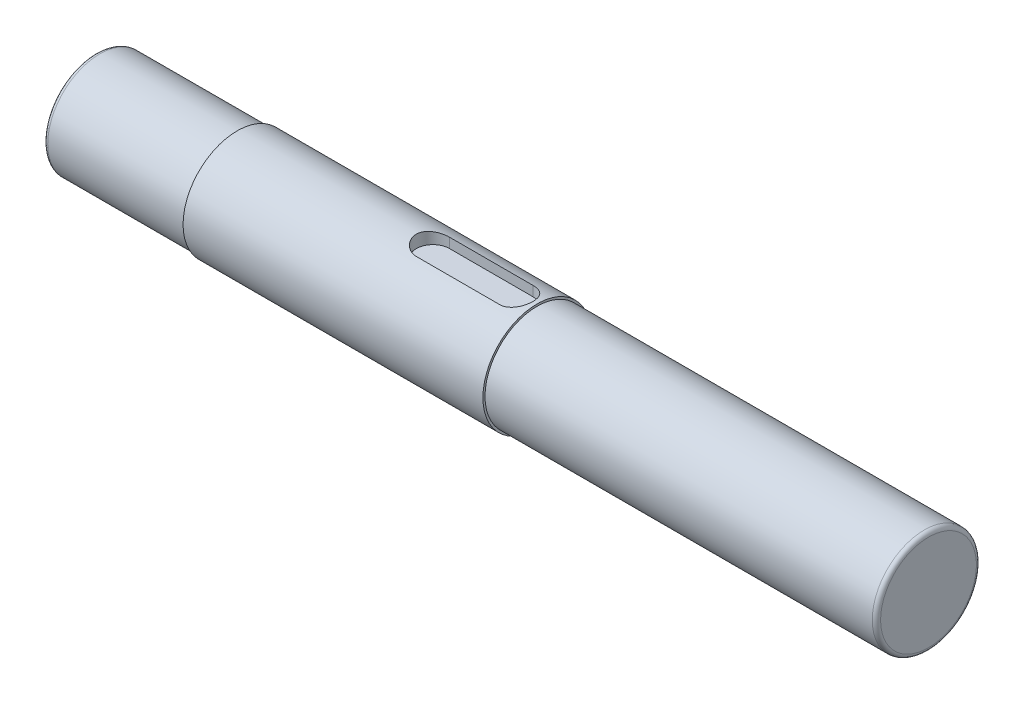
from build123d import *

# Parameters (mm, degrees)
CUT_EXTRUDE27_DEPTH = 3.5
FILLET2_R           = 1
FILLET3_R           = 1
CUT_EXTRUDE29_DEPTH = 3


with BuildPart() as part:
    # Sketch1 → Revolve1 (revolve)
    with BuildSketch(Plane.XY):
        Polygon((7.60952381, 0), (7.60952381, 12.5), (41.60952381, 12.5), (41.60952381, 13), (113.60952381, 13), (113.60952381, 12.5), (207.60952381, 12.5), (207.60952381, 0), align=None)
    revolve(axis=Axis((0, 0, 0), (1, 0, 0)))

    # Sketch16 → Cut-Extrude27 (cut)
    with BuildSketch(Plane(origin=(0, -12.5, 0), x_dir=(-1, 0, 0), z_dir=(0, -1, 0))):
        with BuildLine():
            Line((-139.30952381, 4), (-119.30952381, 4))
            ThreePointArc((-119.30952381, 4), (-115.30952381, 0), (-119.30952381, -4))
            Line((-119.30952381, -4), (-139.30952381, -4))
            ThreePointArc((-139.30952381, -4), (-143.30952381, 0), (-139.30952381, 4))
        make_face()
    extrude(amount=-CUT_EXTRUDE27_DEPTH, mode=Mode.SUBTRACT)

    # Fillet2
    fillet2_edges = [part.edges().sort_by_distance(p)[0] for p in [
        (207.60952381, -12.5, 0),
    ]]
    fillet(fillet2_edges, radius=FILLET2_R)

    # Fillet3
    fillet3_edges = [part.edges().sort_by_distance(p)[0] for p in [
        (7.60952381, -12.5, 0),
    ]]
    fillet(fillet3_edges, radius=FILLET3_R)

    # Sketch20 → Cut-Extrude29 (cut)
    with BuildSketch(Plane(origin=(0, 13, 0), x_dir=(1, 0, 0), z_dir=(0, 1, 0))):
        with BuildLine():
            Line((88.60952381, 4), (108.60952381, 4))
            ThreePointArc((108.60952381, 4), (112.60952381, 0), (108.60952381, -4))
            Line((108.60952381, -4), (88.60952381, -4))
            ThreePointArc((88.60952381, -4), (84.60952381, 0), (88.60952381, 4))
        make_face()
    extrude(amount=-CUT_EXTRUDE29_DEPTH, mode=Mode.SUBTRACT)


solid = part.part
